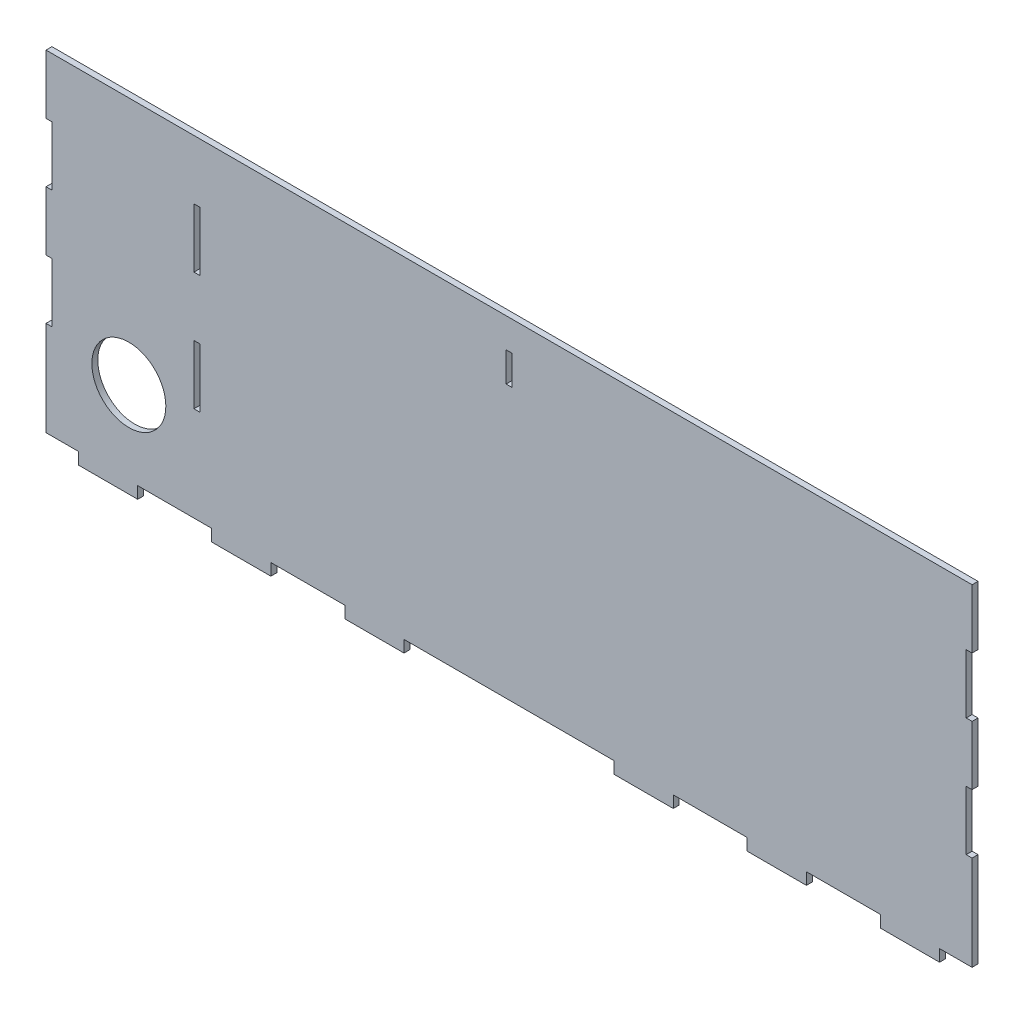
from build123d import *

# Parameters (mm, degrees)
SKETCH2_R               = 12.5
SKETCH2_W               = 2
SKETCH2_H               = 20
BOSS_EXTRUDE1_DEPTH     = 2
CUT_EXTRUDE1_DEPTH      = 168.619360457
CUT_EXTRUDE1_DEPTH_BACK = 168.619360457
SKETCH3_W               = 20
SKETCH3_H               = 2
CUT_EXTRUDE2_DEPTH      = 168.619360457
CUT_EXTRUDE2_DEPTH_BACK = 168.619360457
SKETCH5_W               = 2
SKETCH5_H               = 10


with BuildPart() as part:
    # Sketch2 → Boss-Extrude1 (new body)
    with BuildSketch(Plane.XY):
        Polygon((-100.5, -56), (-100.5, -60), (-80.5, -60), (-80.5, -56), (-55.5, -56), (-55.5, -60), (-35.5, -60), (-35.5, -56), (35.5, -56), (35.5, -60), (55.5, -60), (55.5, -56), (80.5, -56), (80.5, -60), (100.5, -60), (100.5, -56), (125.5, -56), (125.5, -60), (145.5, -60), (145.5, -56), (156.5, -56), (156.5, -24), (154.5, -24), (154.5, -4), (156.5, -4), (156.5, 16), (154.5, 16), (154.5, 36), (156.5, 36), (156.5, 56), (145.5, 56), (145.5, 58), (125.5, 58), (125.5, 56), (100.5, 56), (100.5, 58), (80.5, 58), (80.5, 56), (55.5, 56), (55.5, 58), (35.5, 58), (35.5, 56), (-35.5, 56), (-35.5, 58), (-55.5, 58), (-55.5, 56), (-80.5, 56), (-80.5, 58), (-100.5, 58), (-100.5, 56), (-125.5, 56), (-125.5, 58), (-145.5, 58), (-145.5, 56), (-156.5, 56), (-156.5, 36), (-154.5, 36), (-154.5, 16), (-156.5, 16), (-156.5, -4), (-154.5, -4), (-154.5, -24), (-156.5, -24), (-156.5, -56), (-145.5, -56), (-145.5, -60), (-125.5, -60), (-125.5, -56), align=None)
        with Locations((-128.5, -28)):
            Circle(SKETCH2_R, mode=Mode.SUBTRACT)
        with Locations((-105.5, 26)):
            Rectangle(SKETCH2_W, SKETCH2_H, mode=Mode.SUBTRACT)
        with Locations((-105.5, -14)):
            Rectangle(SKETCH2_W, SKETCH2_H, mode=Mode.SUBTRACT)
    extrude(amount=BOSS_EXTRUDE1_DEPTH)

    # Sketch3 → Cut-Extrude1 (cut, two sides: drawn at the far end of the back side and taken through both)
    with BuildSketch(Plane.XY.offset(2).offset(-CUT_EXTRUDE1_DEPTH_BACK)):
        with Locations((-135.5, 57)):
            Rectangle(SKETCH3_W, SKETCH3_H)
        with Locations((-90.5, 57)):
            Rectangle(SKETCH3_W, SKETCH3_H)
        with Locations((-45.5, 57)):
            Rectangle(SKETCH3_W, SKETCH3_H)
        with Locations((45.5, 57)):
            Rectangle(SKETCH3_W, SKETCH3_H)
        with Locations((90.5, 57)):
            Rectangle(SKETCH3_W, SKETCH3_H)
        with Locations((135.5, 57)):
            Rectangle(SKETCH3_W, SKETCH3_H)
    extrude(amount=CUT_EXTRUDE1_DEPTH + CUT_EXTRUDE1_DEPTH_BACK, mode=Mode.SUBTRACT)

    # Sketch5 → Cut-Extrude2 (cut, two sides: drawn at the far end of the back side and taken through both)
    with BuildSketch(Plane.XY.offset(2).offset(-CUT_EXTRUDE2_DEPTH_BACK)):
        with Locations((0, 41)):
            Rectangle(SKETCH5_W, SKETCH5_H)
    extrude(amount=CUT_EXTRUDE2_DEPTH + CUT_EXTRUDE2_DEPTH_BACK, mode=Mode.SUBTRACT)


solid = part.part
